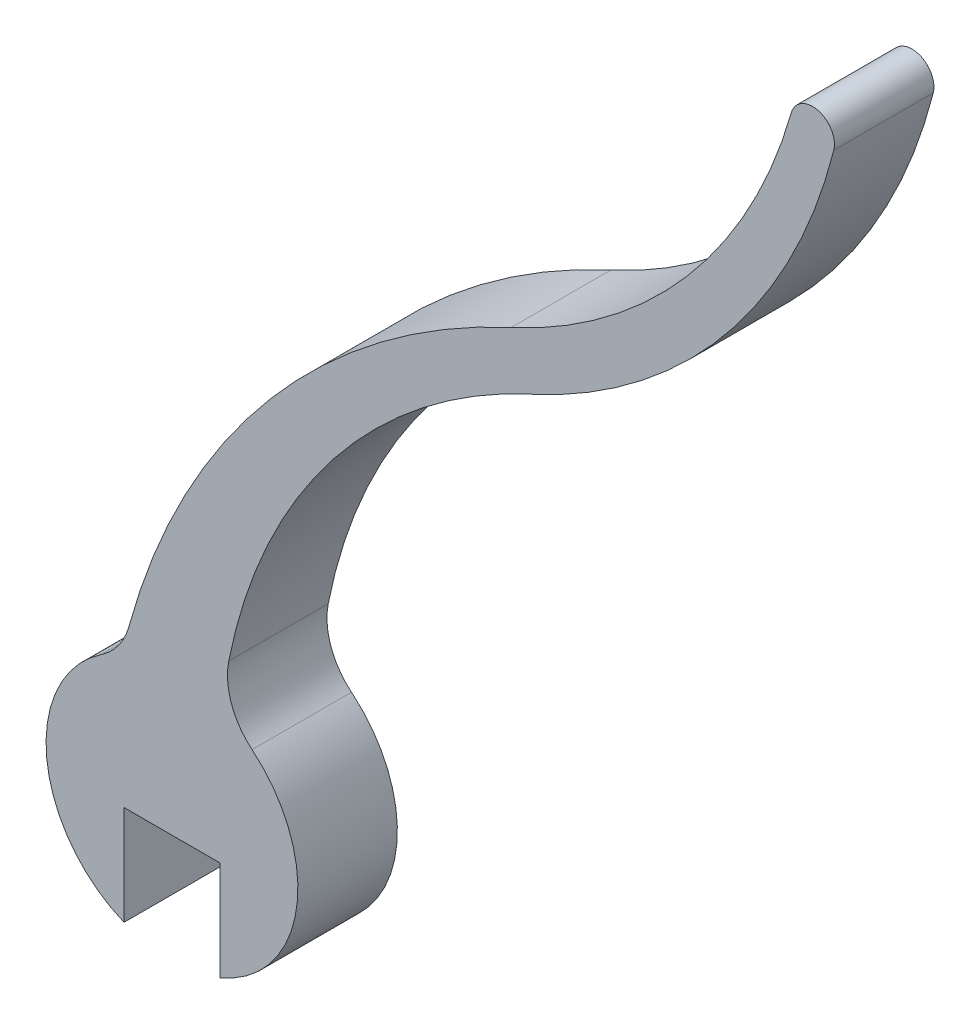
from build123d import *

# Parameters (mm, degrees)
EXTRUDE_1_DEPTH = 3
FILLET_1_R      = 2.032


with BuildPart() as part:
    # 스케치1 → 보스-돌출1 (new body)
    with BuildSketch(Plane.XY):
        with BuildLine():
            Line((-22.703212056, -30.53470544), (-22.703212056, -27.53470544))
            Line((-22.703212056, -27.53470544), (-19.808212056, -27.53470544))
            Line((-19.808212056, -27.53470544), (-19.808212056, -30.53470544))
            ThreePointArc((-19.808212056, -30.53470544), (-17.458089238, -27.052134486), (-19.755712056, -23.53470544))
            ThreePointArc((-19.755712056, -23.53470544), (-16.806747664, -15.831278272), (-10.426669431, -10.603106234))
            ThreePointArc((-10.426669431, -10.603106234), (-4.615473218, -6.174719455), (-1.296316018, 0.334028993))
            ThreePointArc((-1.296316018, 0.334028993), (-1.766656874, 1.136185733), (-2.575803416, 0.677974178))
            ThreePointArc((-2.575803416, 0.677974178), (-5.721510813, -5.168139004), (-11.025821999, -9.160230838))
            ThreePointArc((-11.025821999, -9.160230838), (-18.562919164, -14.982954912), (-22.755712056, -23.53470544))
            ThreePointArc((-22.755712056, -23.53470544), (-25.053334873, -27.052134486), (-22.703212056, -30.53470544))
        make_face()
    extrude(amount=EXTRUDE_1_DEPTH)

    # 필렛1
    fillet_1_edges = [part.edges().sort_by_distance(p)[0] for p in [
        (-22.755712056, -23.53470544, 1.5),
        (-19.755712056, -23.53470544, 1.5),
    ]]
    fillet(fillet_1_edges, radius=FILLET_1_R)


solid = part.part
